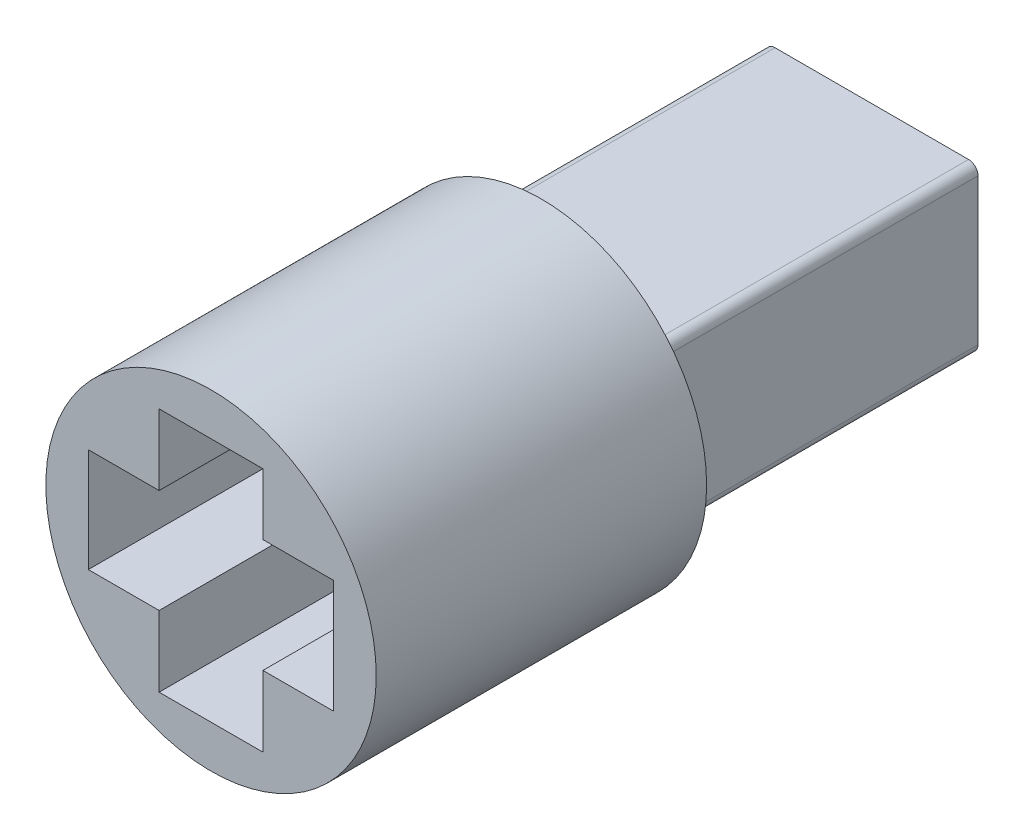
from build123d import *

# Parameters (mm, degrees)
SKETCH2_W           = 3.5
SKETCH2_H           = 4.5
BOSS_EXTRUDE1_DEPTH = 7
SKETCH3_R           = 3.5
BOSS_EXTRUDE2_DEPTH = 7
CUT_EXTRUDE1_DEPTH  = 5
FILLET1_R           = 0.2
FILLET2_R           = 0.2


with BuildPart() as part:
    # Sketch2 → Boss-Extrude1 (new body)
    with BuildSketch(Plane(origin=(0, 0, 0), x_dir=(0, 1, 0), z_dir=(0, 0, 1))):
        with Locations((1.75, 2.25)):
            Rectangle(SKETCH2_W, SKETCH2_H)
    extrude(amount=BOSS_EXTRUDE1_DEPTH)

    # Sketch3 → Boss-Extrude2 (add)
    with BuildSketch(Plane.XY.offset(7)):
        with Locations((-2.25, 1.75)):
            Circle(SKETCH3_R)
    extrude(amount=BOSS_EXTRUDE2_DEPTH)

    # Sketch4 → Cut-Extrude1 (cut)
    with BuildSketch(Plane.XY.offset(14)):
        Polygon((-3.35, 2.85), (-4.85, 2.85), (-4.85, 0.65), (-3.35, 0.65), (-3.35, -0.85), (-1.15, -0.85), (-1.15, 0.65), (0.35, 0.65), (0.35, 3.05), (-1.15, 3.05), (-1.15, 4.35), (-3.35, 4.35), align=None)
    extrude(amount=-CUT_EXTRUDE1_DEPTH, mode=Mode.SUBTRACT)

    # Fillet1
    fillet1_edges = [part.edges().sort_by_distance(p)[0] for p in [
        (0, 3.5, 3.5),
    ]]
    fillet(fillet1_edges, radius=FILLET1_R)

    # Fillet2
    fillet2_edges = [part.edges().sort_by_distance(p)[0] for p in [
        (-4.5, 0, 3.5),
        (-4.5, 3.5, 3.5),
        (0, 0, 3.5),
    ]]
    fillet(fillet2_edges, radius=FILLET2_R)


solid = part.part
